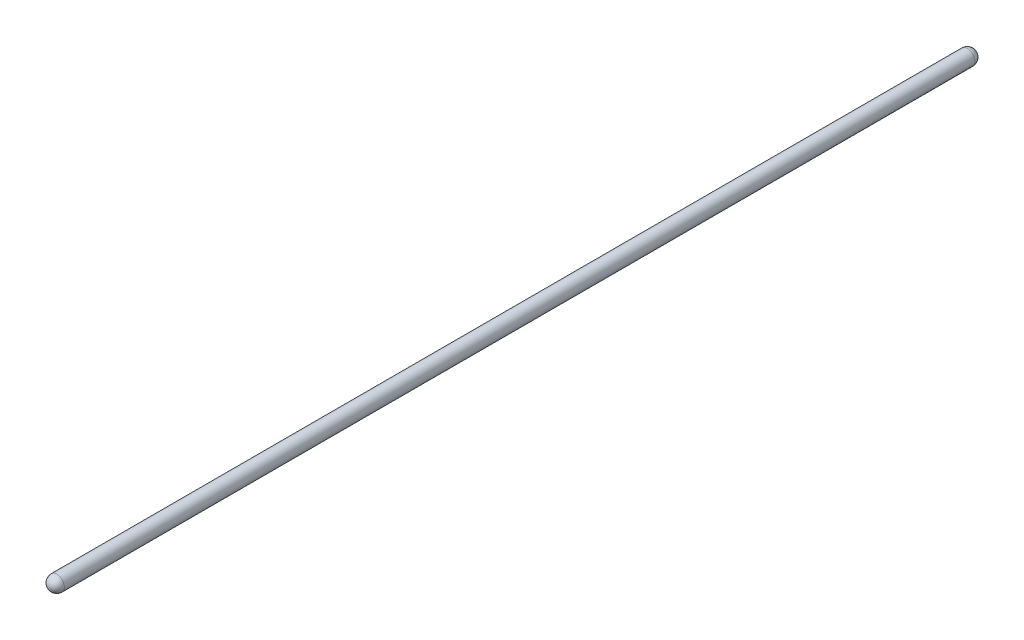
from build123d import *

# Parameters (mm, degrees)
ESQUISSE2_R          = 0.5
BASE_EXTRUSION_DEPTH = 60


with BuildPart() as part:
    # Esquisse2 → Base-Extrusion (new body)
    with BuildSketch(Plane.XY):
        Circle(ESQUISSE2_R)
    extrude(amount=BASE_EXTRUSION_DEPTH)

    # Esquisse7 → Boss.-Révol.1 (revolve)
    with BuildSketch(Plane(origin=(0, 0, 0), x_dir=(1, 0, 0), z_dir=(0, 1, 0))):
        with BuildLine():
            Line((0, -60), (0, -60.5))
            ThreePointArc((0, -60.5), (-0.353553391, -60.353553391), (-0.5, -60))
            Line((-0.5, -60), (0, -60))
        make_face()
    revolve(axis=Axis((0, 0, 66.095405801), (0, 0, -1)))

    # Esquisse8 → Boss.-Révol.2 (revolve)
    with BuildSketch(Plane(origin=(0, 0, 0), x_dir=(1, 0, 0), z_dir=(0, 1, 0))):
        with BuildLine():
            Line((0, 0), (-0.5, 0))
            ThreePointArc((-0.5, 0), (-0.353553391, 0.353553391), (0, 0.5))
            Line((0, 0.5), (0, 0))
        make_face()
    revolve(axis=Axis((0, 0, -7.993801509), (0, 0, 1)))


solid = part.part
